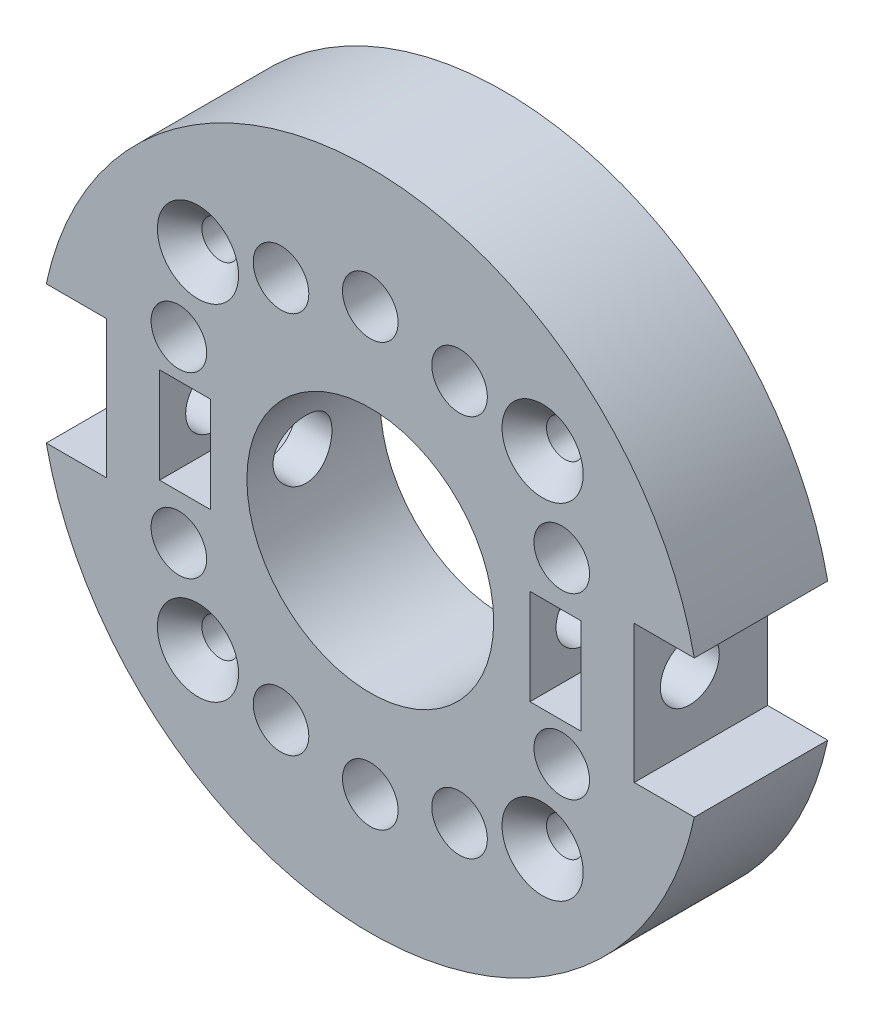
from build123d import *

# Parameters (mm, degrees)
ESQUISSE1_R                         = 1.65
ESQUISSE1_R_2                       = 2.5
ESQUISSE1_W                         = 4.6
ESQUISSE1_H                         = 8.6
ESQUISSE1_R_3                       = 11.1
BOSS_EXTRU_1_DEPTH                  = 12
CHANFREIN1_SIZE                     = 2
ENL_V_MAT_EXTRU_1_REACH             = 56.08
ESQUISSE2_R                         = 2.65
ENL_V_MAT_EXTRU_1_DIRECTION_2_DEPTH = 55.07996437
R_P_TITION_CIRCULAIRE1_COUNT        = 2
ENL_V_MAT_EXTRU_3_DEPTH             = 8


with BuildPart() as part:
    # Esquisse1 → Boss.-Extru.1 (new body)
    with BuildSketch(Plane.XY):
        with BuildLine():
            Line((-23.741352507, 6.2), (-23.741352507, -6.2))
            Line((-23.741352507, -6.2), (-29.147898724, -6.2))
            ThreePointArc((-29.147898724, -6.2), (-21.071782079, -21.071782079), (-6.2, -29.147898724))
            ThreePointArc((-6.2, -29.147898724), (0, -29.8), (6.2, -29.147898724))
            ThreePointArc((6.2, -29.147898724), (21.071782079, -21.071782079), (29.147898724, -6.2))
            Line((29.147898724, -6.2), (23.741352507, -6.2))
            Line((23.741352507, -6.2), (23.741352507, 6.2))
            Line((23.741352507, 6.2), (29.147898724, 6.2))
            ThreePointArc((29.147898724, 6.2), (0, 29.8), (-29.147898724, 6.2))
            Line((-29.147898724, 6.2), (-23.741352507, 6.2))
        make_face()
        with Locations((-15.5, -15.5)):
            Circle(ESQUISSE1_R, mode=Mode.SUBTRACT)
        with Locations((-8.029746973, -17.219847954)):
            Circle(ESQUISSE1_R_2, mode=Mode.SUBTRACT)
        with Locations((-17.219847954, -8.029746973)):
            Circle(ESQUISSE1_R_2, mode=Mode.SUBTRACT)
        with Locations((0, -19)):
            Circle(ESQUISSE1_R_2, mode=Mode.SUBTRACT)
        with Locations((8.029746973, -17.219847954)):
            Circle(ESQUISSE1_R_2, mode=Mode.SUBTRACT)
        with Locations((15.5, -15.5)):
            Circle(ESQUISSE1_R, mode=Mode.SUBTRACT)
        with Locations((17.219847954, -8.029746973)):
            Circle(ESQUISSE1_R_2, mode=Mode.SUBTRACT)
        with Locations((16.656153343, -0.3)):
            Rectangle(ESQUISSE1_W, ESQUISSE1_H, mode=Mode.SUBTRACT)
        with Locations((-16.656153343, 0.3)):
            Rectangle(ESQUISSE1_W, ESQUISSE1_H, mode=Mode.SUBTRACT)
        with Locations((-17.219847954, 8.029746973)):
            Circle(ESQUISSE1_R_2, mode=Mode.SUBTRACT)
        with Locations((-15.5, 15.5)):
            Circle(ESQUISSE1_R, mode=Mode.SUBTRACT)
        with Locations((-8.029746973, 17.219847954)):
            Circle(ESQUISSE1_R_2, mode=Mode.SUBTRACT)
        Circle(ESQUISSE1_R_3, mode=Mode.SUBTRACT)
        with Locations((17.219847954, 8.029746973)):
            Circle(ESQUISSE1_R_2, mode=Mode.SUBTRACT)
        with Locations((0, 19)):
            Circle(ESQUISSE1_R_2, mode=Mode.SUBTRACT)
        with Locations((8.029746973, 17.219847954)):
            Circle(ESQUISSE1_R_2, mode=Mode.SUBTRACT)
        with Locations((15.5, 15.5)):
            Circle(ESQUISSE1_R, mode=Mode.SUBTRACT)
    extrude(amount=BOSS_EXTRU_1_DEPTH)

    # Chanfrein1
    chanfrein1_edges = [part.edges().sort_by_distance(p)[0] for p in [
        (13.85, 15.5, 12),
        (13.85, -15.5, 12),
        (-17.15, -15.5, 12),
        (-17.15, 15.5, 12),
    ]]
    chamfer(chanfrein1_edges, length=CHANFREIN1_SIZE)

    # Esquisse2 → Enlèv. mat.-Extru.1 (cut, up to next)
    with BuildSketch(Plane.ZY.offset(14.356153343), mode=Mode.PRIVATE) as enl_v_mat_extru_1_sk1:
        with Locations((7, 0)):
            Circle(ESQUISSE2_R)
    enl_v_mat_extru_1_tool1 = extrude(enl_v_mat_extru_1_sk1.sketch, amount=-ENL_V_MAT_EXTRU_1_REACH, mode=Mode.PRIVATE) & part.part
    enl_v_mat_extru_1 = enl_v_mat_extru_1_tool1.solids().sort_by_distance((-14.356153, 0, 7))[0]
    add(enl_v_mat_extru_1, mode=Mode.SUBTRACT)

    # Esquisse2 → Enlèv. mat.-Extru.1 direction 2 (cut)
    with BuildSketch(Plane.ZY.offset(14.356153343)):
        with Locations((7, 0)):
            Circle(ESQUISSE2_R)
    enl_v_mat_extru_1_direction_2 = extrude(amount=ENL_V_MAT_EXTRU_1_DIRECTION_2_DEPTH, mode=Mode.SUBTRACT)

    # Répétition circulaire1: Enlèv. mat.-Extru.1, Enlèv. mat.-Extru.1 direction 2 ×2 about axis
    r_p_tition_circulaire1_axis = Axis((0, 0, 12), (0, 0, 1))
    add([enl_v_mat_extru_1.rotate(r_p_tition_circulaire1_axis, i * 360 / R_P_TITION_CIRCULAIRE1_COUNT) for i in range(1, R_P_TITION_CIRCULAIRE1_COUNT)], mode=Mode.SUBTRACT)
    add([enl_v_mat_extru_1_direction_2.rotate(r_p_tition_circulaire1_axis, i * 360 / R_P_TITION_CIRCULAIRE1_COUNT) for i in range(1, R_P_TITION_CIRCULAIRE1_COUNT)], mode=Mode.SUBTRACT)

    # Esquisse4 → Enlèv. mat.-Extru.3 (cut)
    with BuildSketch(Plane(origin=(0, 0, 0), x_dir=(-1, 0, 0), z_dir=(0, 0, -1))):
        Polygon((0, 14.381197846), (4, 16.690598923), (4, 21.309401077), (0, 23.618802154), (-4, 21.309401077), (-4, 16.690598923), align=None)
        Polygon((0, -14.381197846), (-4, -16.690598923), (-4, -21.309401077), (0, -23.618802154), (4, -21.309401077), (4, -16.690598923), align=None)
    extrude(amount=-ENL_V_MAT_EXTRU_3_DEPTH, mode=Mode.SUBTRACT)


solid = part.part
